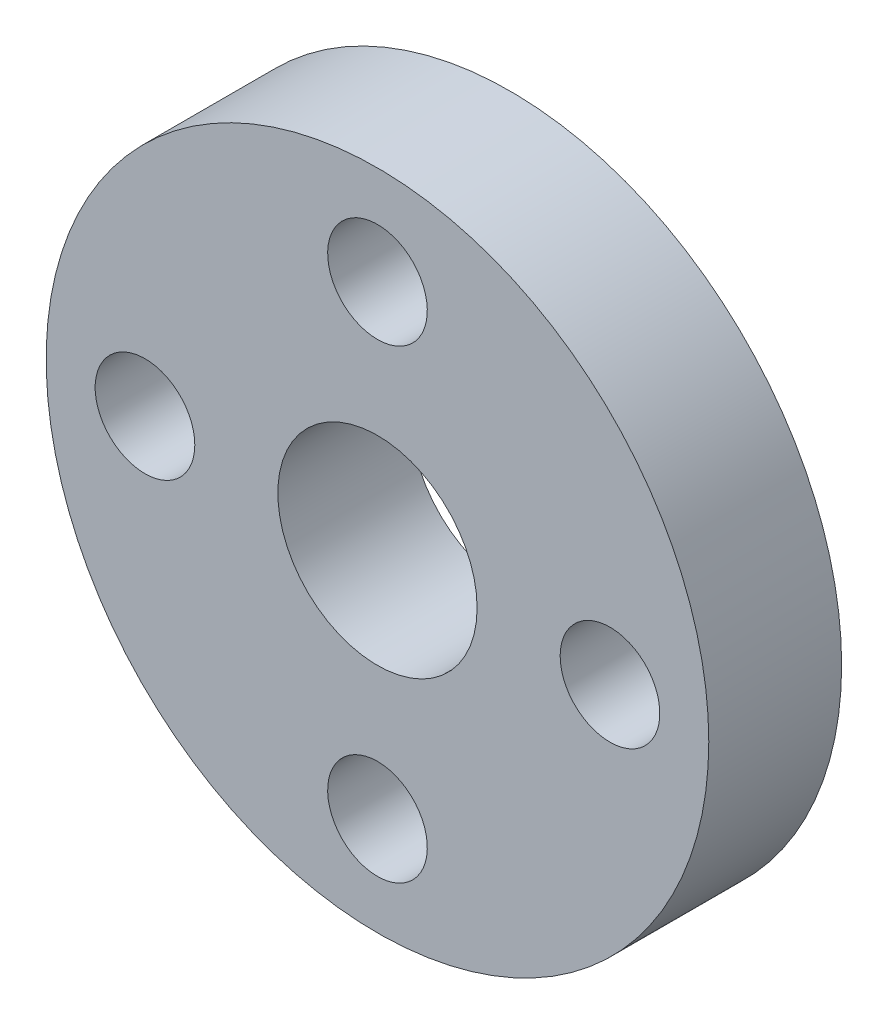
from build123d import *

# Parameters (mm, degrees)
SKETCH_1_R               = 9.975
EXTRUDE_1_DEPTH          = 4
SKETCH_2_R               = 1.5
CUT_EXTRUDE_1_DEPTH      = 15.662920923
PATTERN_CIRCULAR_1_COUNT = 4
SKETCH_3_R               = 3
CUT_EXTRUDE_2_DEPTH      = 15.662920923


with BuildPart() as part:
    # 草图1 → 凸台-拉伸1 (new body)
    with BuildSketch(Plane.XY):
        Circle(SKETCH_1_R)
    extrude(amount=EXTRUDE_1_DEPTH)

    # 草图2 → 切除-拉伸1 (cut, through all)
    with BuildSketch(Plane.XY.offset(4)):
        with Locations((-7, 0)):
            Circle(SKETCH_2_R)
    cut_extrude_1 = extrude(amount=-CUT_EXTRUDE_1_DEPTH, mode=Mode.SUBTRACT)

    # 阵列(圆周)1: 切除-拉伸1 ×4 about axis
    pattern_circular_1_axis = Axis((0, 0, 0), (0, 0, 1))
    for i in range(1, PATTERN_CIRCULAR_1_COUNT):
        add(cut_extrude_1.rotate(pattern_circular_1_axis, i * 360 / PATTERN_CIRCULAR_1_COUNT), mode=Mode.SUBTRACT)

    # 草图3 → 切除-拉伸2 (cut, through all)
    with BuildSketch(Plane.XY.offset(4)):
        Circle(SKETCH_3_R)
    extrude(amount=-CUT_EXTRUDE_2_DEPTH, mode=Mode.SUBTRACT)


solid = part.part
